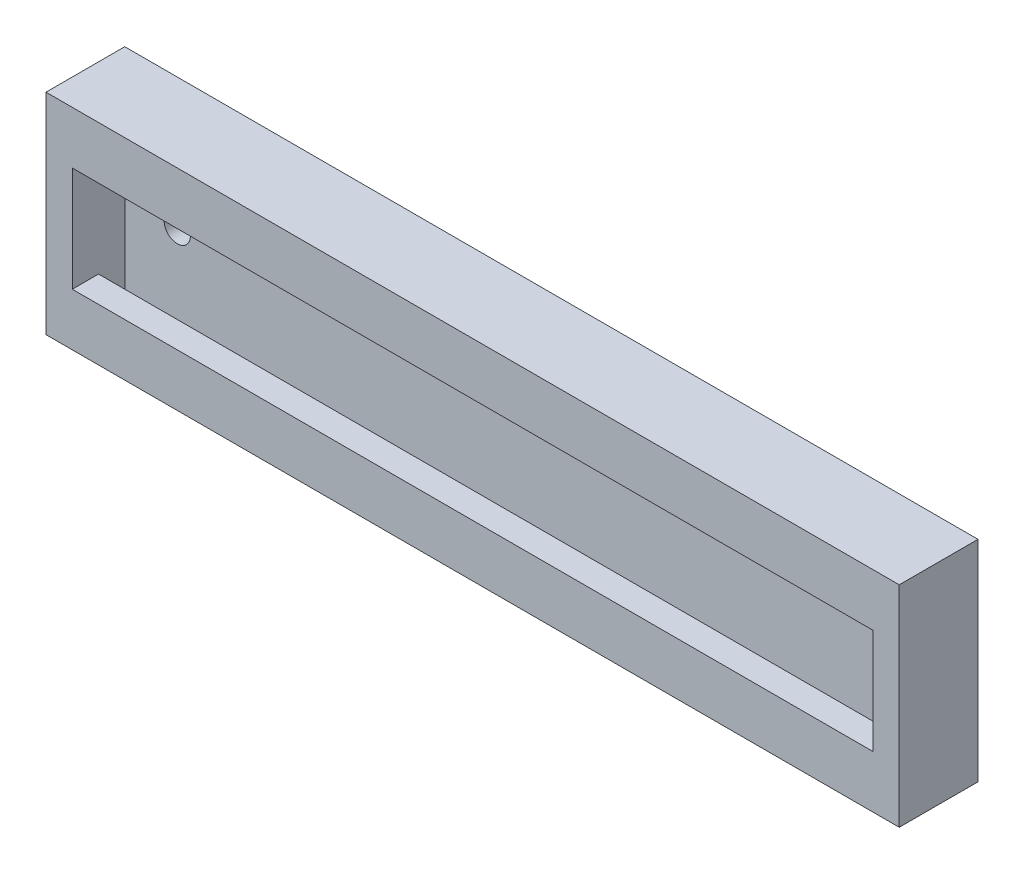
from build123d import *

# Parameters (mm, degrees)
SKETCH1_W           = 65
SKETCH1_H           = 16
BOSS_EXTRUDE1_DEPTH = 2
SKETCH2_W           = 65
SKETCH2_H           = 16
SKETCH2_W_2         = 61
SKETCH2_H_2         = 12
BOSS_EXTRUDE2_DEPTH = 2
SKETCH4_W           = 65
SKETCH4_H           = 16
SKETCH4_W_2         = 61
SKETCH4_H_2         = 8
BOSS_EXTRUDE3_DEPTH = 2
SKETCH5_R           = 1
CUT_EXTRUDE1_DEPTH  = 1


with BuildPart() as part:
    # Sketch1 → Boss-Extrude1 (new body)
    with BuildSketch(Plane.XY):
        Rectangle(SKETCH1_W, SKETCH1_H)
    extrude(amount=BOSS_EXTRUDE1_DEPTH)

    # Sketch2 → Boss-Extrude2 (add)
    with BuildSketch(Plane.XY.offset(2)):
        Rectangle(SKETCH2_W, SKETCH2_H)
        Rectangle(SKETCH2_W_2, SKETCH2_H_2, mode=Mode.SUBTRACT)
    extrude(amount=BOSS_EXTRUDE2_DEPTH)

    # Sketch4 → Boss-Extrude3 (add)
    with BuildSketch(Plane.XY.offset(4)):
        Rectangle(SKETCH4_W, SKETCH4_H)
        Rectangle(SKETCH4_W_2, SKETCH4_H_2, mode=Mode.SUBTRACT)
    extrude(amount=BOSS_EXTRUDE3_DEPTH)

    # Sketch5 → Cut-Extrude1 (cut)
    with BuildSketch(Plane.XY.offset(2)):
        with Locations((-26.5, 0)):
            Circle(SKETCH5_R)
    extrude(amount=-CUT_EXTRUDE1_DEPTH, mode=Mode.SUBTRACT)


solid = part.part
